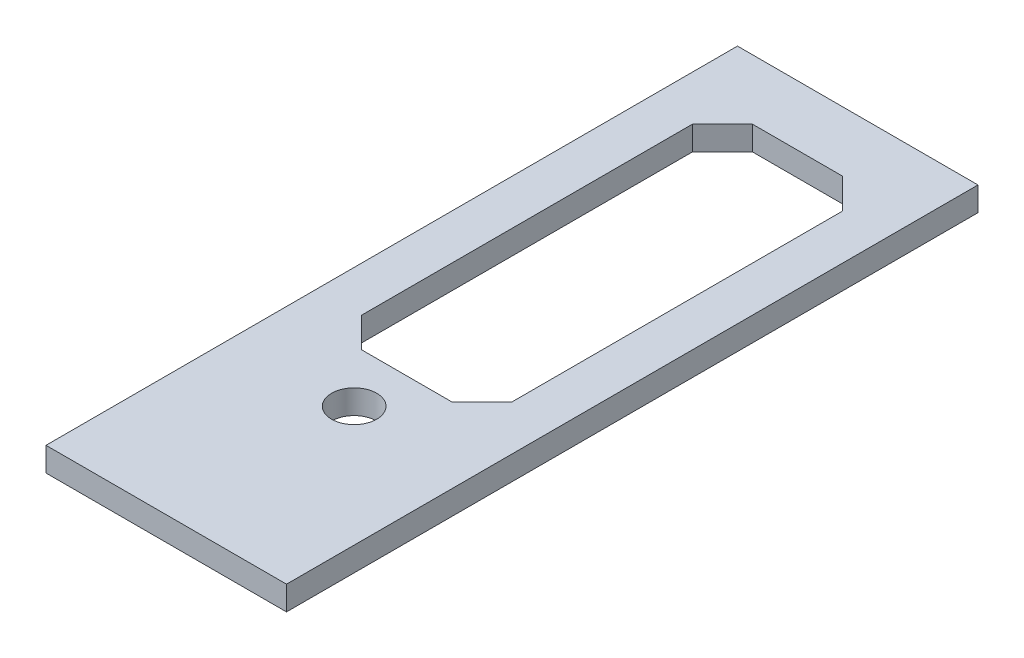
from build123d import *

# Parameters (mm, degrees)
SKETCH1_W           = 16
SKETCH1_H           = 46
BOSS_EXTRUDE1_DEPTH = 1.6
SKETCH3_W           = 10
SKETCH3_H           = 26
CUT_EXTRUDE2_DEPTH  = 1.6
CHAMFER2_SIZE       = 2
SKETCH4_R           = 1.5
CUT_EXTRUDE3_DEPTH  = 1.6


with BuildPart() as part:
    # Sketch1 → Boss-Extrude1 (new body)
    with BuildSketch(Plane(origin=(0, 0, 0), x_dir=(1, 0, 0), z_dir=(0, 1, 0))):
        Rectangle(SKETCH1_W, SKETCH1_H)
    extrude(amount=BOSS_EXTRUDE1_DEPTH)

    # Sketch3 → Cut-Extrude2 (cut)
    with BuildSketch(Plane(origin=(0, 1.6, 0), x_dir=(1, 0, 0), z_dir=(0, 1, 0))):
        with Locations((0, 6)):
            Rectangle(SKETCH3_W, SKETCH3_H)
    extrude(amount=-CUT_EXTRUDE2_DEPTH, mode=Mode.SUBTRACT)

    # Chamfer2
    chamfer2_edges = [part.edges().sort_by_distance(p)[0] for p in [
        (5, 0.8, 7),
        (5, 0.8, -19),
        (-5, 0.8, -19),
        (-5, 0.8, 7),
    ]]
    chamfer(chamfer2_edges, length=CHAMFER2_SIZE)

    # Sketch4 → Cut-Extrude3 (cut)
    with BuildSketch(Plane(origin=(0, 1.6, 0), x_dir=(1, 0, 0), z_dir=(0, 1, 0))):
        with Locations(Location((0, -10.5, 0), (0, 0, 270))):
            Circle(SKETCH4_R)
    extrude(amount=-CUT_EXTRUDE3_DEPTH, mode=Mode.SUBTRACT)


solid = part.part
